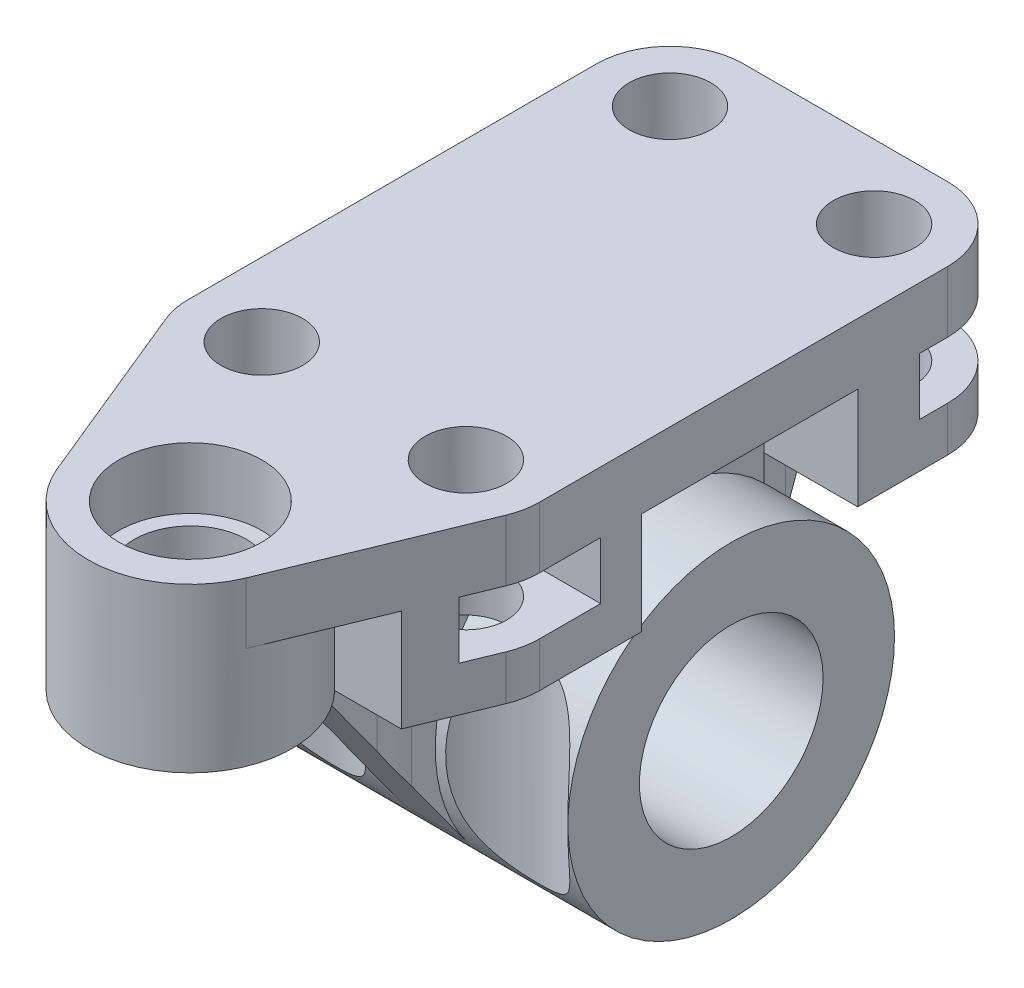
from build123d import *
from build123d.topology import SkipClean

# Parameters (mm, degrees)
SKETCH1_R                      = 8
SKETCH1_R_2                    = 4.5
BOSS_EXTRUDE1_DEPTH            = 8
BOSS_EXTRUDE_FLANGE_DEPTH      = 2
BOSS_EXTRUDE_FLANGE_DEPTH_BACK = 1
SKETCH2_R                      = 3.5
SKETCH2_R_2                    = 2
SKETCH3_R                      = 2
BOSS_EXTRUDE3_DEPTH            = 5
CUT_EXTRUDE1_DEPTH             = 2.8
BOSS_EXTRUDE6_DEPTH            = 1.5
BOSS_EXTRUDE7_REACH            = 34.035
BOSS_EXTRUDE7_END_RADIUS       = 8
SKETCH6_W                      = 8
SKETCH6_H                      = 10.6
SKETCH9_R                      = 3.6
CUT_EXTRUDE2_DEPTH             = 30.175503423
CUT_EXTRUDE3_DEPTH             = 34.988380435
CUT_EXTRUDE3_DEPTH_BACK        = 34.988380435
SKETCH10_R                     = 4.5


with BuildPart() as part:
    # Sketch1 → Boss-Extrude1 (new, symmetric)
    with BuildSketch(Plane(origin=(0, 0, 0), x_dir=(0, 0, -1), z_dir=(1, 0, 0))):
        with Locations((0, -15)):
            Circle(SKETCH1_R)
        with Locations((0, -15)):
            Circle(SKETCH1_R_2, mode=Mode.SUBTRACT)
    extrude(amount=BOSS_EXTRUDE1_DEPTH, both=True)



with BuildPart() as body_2:
    # Sketch2 → Boss-Extrude Flange (new, two sides: drawn at the far end of the back side and taken through both)
    with BuildSketch(Plane(origin=(0, -2, 0), x_dir=(1, 0, 0), z_dir=(0, 1, 0)).offset(-BOSS_EXTRUDE_FLANGE_DEPTH_BACK)):
        with BuildLine():
            Line((-5, 13.6), (5, 13.6))
            ThreePointArc((5, 13.6), (7.545584412, 12.545584412), (8.6, 10))
            Line((8.6, 10), (8.6, -10))
            ThreePointArc((8.6, -10), (8.532023483, -10.696283073), (8.330661045, -11.366271203))
            Line((8.330661045, -11.366271203), (4.625918119, -20.397598893))
            ThreePointArc((4.625918119, -20.397598893), (0, -23.5), (-4.625918119, -20.397598893))
            Line((-4.625918119, -20.397598893), (-8.330661045, -11.366271203))
            ThreePointArc((-8.330661045, -11.366271203), (-8.532023483, -10.696283073), (-8.6, -10))
            Line((-8.6, -10), (-8.6, 10))
            ThreePointArc((-8.6, 10), (-7.545584412, 12.545584412), (-5, 13.6))
        make_face()
        with Locations((0, -18.5)):
            Circle(SKETCH2_R, mode=Mode.SUBTRACT)
        with Locations((5, -10)):
            Circle(SKETCH2_R_2, mode=Mode.SUBTRACT)
        with Locations((-5, -10)):
            Circle(SKETCH2_R_2, mode=Mode.SUBTRACT)
        with Locations((5, 10)):
            Circle(SKETCH2_R_2, mode=Mode.SUBTRACT)
        with Locations((-5, 10)):
            Circle(SKETCH2_R_2, mode=Mode.SUBTRACT)
    extrude(amount=BOSS_EXTRUDE_FLANGE_DEPTH + BOSS_EXTRUDE_FLANGE_DEPTH_BACK)

    # Sketch3 → Boss-Extrude3 (add)
    # profile 1 of 3: a face of its own
    with SkipClean():  # the faces are left unmerged after this step: merging them gives an invalid solid
        with BuildSketch(Plane.XZ.offset(3)):
            with BuildLine():
                Line((5, -13.6), (0.6, -13.6))
                Line((0.6, -13.6), (0.6, -5.6))
                Line((0.6, -5.6), (8.6, -5.6))
                Line((8.6, -5.6), (8.6, -10))
                ThreePointArc((8.6, -10), (7.545584412, -12.545584412), (5, -13.6))
            make_face()
            with Locations((5, -10)):
                Circle(SKETCH3_R, mode=Mode.SUBTRACT)
        # profile 2 of 3: a face of its own
        with BuildSketch(Plane.XZ.offset(3)):
            with BuildLine():
                Line((-0.6, -13.6), (-5, -13.6))
                ThreePointArc((-5, -13.6), (-7.545584412, -12.545584412), (-8.6, -10))
                Line((-8.6, -10), (-8.6, -5.6))
                Line((-8.6, -5.6), (-0.6, -5.6))
                Line((-0.6, -5.6), (-0.6, -13.6))
            make_face()
            with Locations((-5, -10)):
                Circle(SKETCH3_R, mode=Mode.SUBTRACT)
        # profile 3 of 3: a face of its own
        with BuildSketch(Plane.XZ.offset(3)):
            with BuildLine():
                Line((-1.4, 5), (-8.6, 5))
                Line((-8.6, 5), (-8.6, 10))
                ThreePointArc((-8.6, 10), (-8.532023483, 10.696283073), (-8.330661045, 11.366271203))
                Line((-8.330661045, 11.366271203), (-6.840068353, 15))
                Line((-6.840068353, 15), (-3.570714214, 15))
                ThreePointArc((-3.570714214, 15), (0, 23.5), (3.570714214, 15))
                Line((3.570714214, 15), (6.840068353, 15))
                Line((6.840068353, 15), (8.330661045, 11.366271203))
                ThreePointArc((8.330661045, 11.366271203), (8.532023483, 10.696283073), (8.6, 10))
                Line((8.6, 10), (8.6, 5))
                Line((8.6, 5), (1.4, 5))
                Line((1.4, 5), (1.4, 8.5))
                Line((1.4, 8.5), (-1.4, 8.5))
                Line((-1.4, 8.5), (-1.4, 5))
            make_face()
            with Locations((-5, 10)):
                Circle(SKETCH3_R, mode=Mode.SUBTRACT)
            with Locations((5, 10)):
                Circle(SKETCH3_R, mode=Mode.SUBTRACT)
        extrude(amount=BOSS_EXTRUDE3_DEPTH)

    # Sketch4 → Cut-Extrude1 (cut)
    with SkipClean():  # the faces are left unmerged after this step: merging them gives an invalid solid
        with BuildSketch(Plane.XZ.offset(3)):
            Polygon((9.617691454, -9.201923789), (8, -8.267949192), (5, -6.535898385), (2, -8.267949192), (2, -11.732050808), (6.617691454, -14.398076211), align=None)
            Polygon((-8.6, 7), (-3.267949192, 7), (-1.535898385, 10), (-3.267949192, 13), (-6.732050808, 13), (-8.6, 13), (-8.6, 10.235382907), align=None)
            Polygon((-6.617691454, -14.398076211), (-2, -11.732050808), (-2, -8.267949192), (-5, -6.535898385), (-8, -8.267949192), (-9.617691454, -9.201923789), (-8.235382907, -11.596152423), align=None)
            Polygon((3.267949192, 7), (8.6, 7), (8.6, 13), (6.732050808, 13), (3.267949192, 13), (1.535898385, 10), align=None)
        extrude(amount=CUT_EXTRUDE1_DEPTH, mode=Mode.SUBTRACT)


with BuildPart() as part_1:
    with SkipClean():  # the faces are left unmerged after this step: merging them gives an invalid solid
        add(part.part)

        add(body_2.part)  # Boss-Extrude6 merges body 2
        # Sketch5 → Boss-Extrude6 (add, symmetric)
        with BuildSketch(Plane(origin=(0, 0, 0), x_dir=(0, 0, -1), z_dir=(1, 0, 0))):
            Polygon((-15, -8), (-6.465390868, -19.71155186), (7.397385367, -18.046094177), (13.593063648, -3), (13.6, 0), (-15, 0), align=None)
        extrude(amount=BOSS_EXTRUDE6_DEPTH, both=True)

    # Boss-Extrude7: up to this cylinder (the profile starts outside it)
    with SkipClean():  # the faces are left unmerged after this step: merging them gives an invalid solid
        boss_extrude7_end = Plane(origin=(0, -15, 0), z_dir=(-1, 0, 0)) * Cylinder(BOSS_EXTRUDE7_END_RADIUS, 85.07, mode=Mode.PRIVATE)
        # Sketch6 → Boss-Extrude7 (add, up to the surface)
        with BuildSketch(Plane.XZ.offset(3), mode=Mode.PRIVATE) as boss_extrude7_sk1:
            with Locations((0, -0.3)):
                Rectangle(SKETCH6_W, SKETCH6_H)
        boss_extrude7_tool1 = extrude(boss_extrude7_sk1.sketch, amount=BOSS_EXTRUDE7_REACH, mode=Mode.PRIVATE) - boss_extrude7_end
        add(boss_extrude7_tool1.solids().sort_by_distance((0, -3, -0.3))[0])

    # Sketch9 → Cut-Extrude2 (cut, through all)
    with SkipClean():  # the faces are left unmerged after this step: merging them gives an invalid solid
        with BuildSketch(Plane.XZ.offset(8)):
            with Locations((0, 18.5)):
                Circle(SKETCH9_R)
            with Locations((-5, 10)):
                Circle(SKETCH9_R)
            with Locations((5, 10)):
                Circle(SKETCH9_R)
            with Locations((5, -10)):
                Circle(SKETCH9_R)
            with Locations((-5, -10)):
                Circle(SKETCH9_R)
        extrude(amount=CUT_EXTRUDE2_DEPTH, mode=Mode.SUBTRACT)

    # Sketch10 → Cut-Extrude3 (cut, two sides: drawn at the far end of the back side and taken through both)
    with SkipClean():  # the faces are left unmerged after this step: merging them gives an invalid solid
        with BuildSketch(Plane(origin=(0, 0, 0), x_dir=(0, 0, -1), z_dir=(1, 0, 0)).offset(-CUT_EXTRUDE3_DEPTH_BACK)):
            with Locations((0, -15)):
                Circle(SKETCH10_R)
        extrude(amount=CUT_EXTRUDE3_DEPTH + CUT_EXTRUDE3_DEPTH_BACK, mode=Mode.SUBTRACT)

    # Sketch8 → Cut-Revolve2 (revolve, cut)
    with SkipClean():  # the faces are left unmerged after this step: merging them gives an invalid solid
        with BuildSketch(Plane(origin=(0, 0, 0), x_dir=(0, 0, -1), z_dir=(1, 0, 0))):
            Polygon((-21.25, -2), (-22, -2), (-22, 0), (-18.5, 0), (-18.5, -8), (-22, -8), (-22, -5), (-21.25, -5), align=None)
        revolve(axis=Axis((0, -3, 18.5), (0, 1, 0)), mode=Mode.SUBTRACT)


solid = part_1.part
